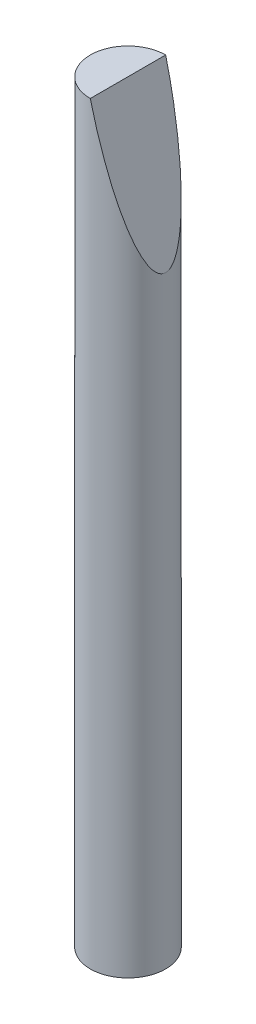
from build123d import *

# Parameters (mm, degrees)
SKETCH_1_R               = 1
EXTRUDE_1_DEPTH          = 20
CUT_EXTRUDE_1_DEPTH      = 21.049937656
CUT_EXTRUDE_1_DEPTH_BACK = 21.049937656


with BuildPart() as part:
    # 草图1 → 凸台-拉伸1 (new body)
    with BuildSketch(Plane(origin=(0, 0, 0), x_dir=(1, 0, 0), z_dir=(0, 1, 0))):
        with Locations(Location((0, 0, 0), (0, 0, 270))):
            Circle(SKETCH_1_R)
    extrude(amount=EXTRUDE_1_DEPTH)

    # 草图2 → 切除-拉伸1 (cut, two sides: drawn at the far end of the back side and taken through both)
    with BuildSketch(Plane.XY.offset(-CUT_EXTRUDE_1_DEPTH_BACK)):
        Polygon((1, 16), (1, 20), (0, 20), align=None)
    extrude(amount=CUT_EXTRUDE_1_DEPTH + CUT_EXTRUDE_1_DEPTH_BACK, mode=Mode.SUBTRACT)


solid = part.part
